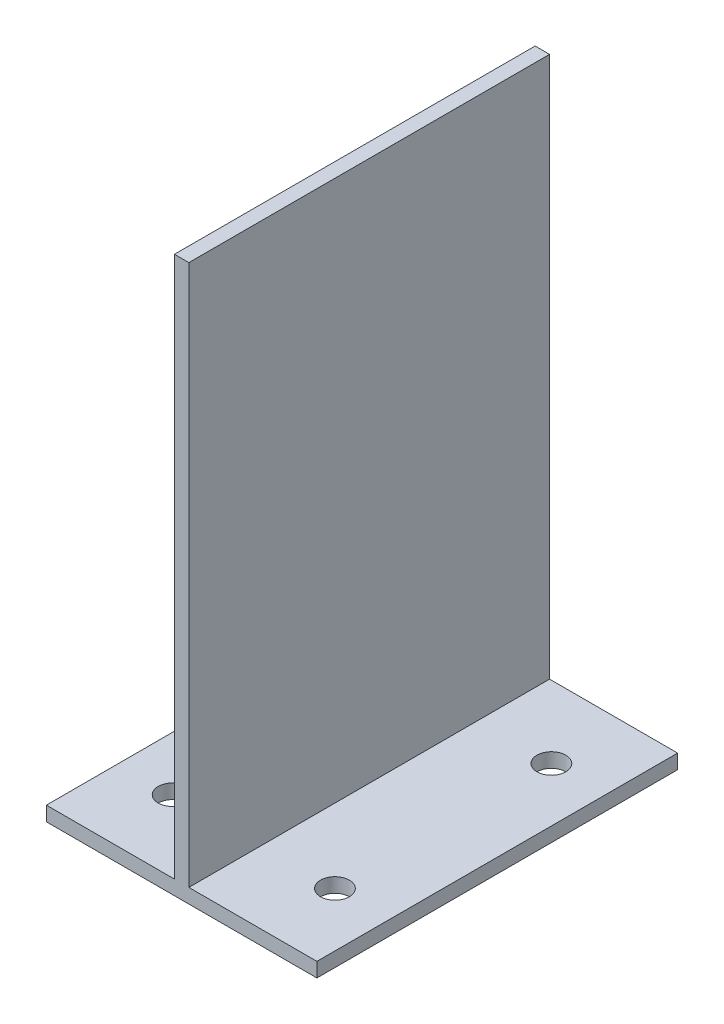
from build123d import *

# Parameters (mm, degrees)
BOSS_EXTRUDE1_DEPTH      = 200
F_16_0_MM_DOWEL_HOLES1_D = 16


with BuildPart() as part:
    # Sketch1 → Boss-Extrude1 (new body)
    with BuildSketch(Plane.XY):
        Polygon((-4, 308), (-4, 8), (-75, 8), (-75, 0), (75, 0), (75, 8), (4, 8), (4, 308), align=None)
    extrude(amount=BOSS_EXTRUDE1_DEPTH)

    # Ø16.0 mm Dowel Holes1 (through all)
    with Locations(Plane(origin=(0, 0, 0), x_dir=(-1, 0, 0), z_dir=(0, -1, 0))):
        with Locations((-45, -40), (-45, -160), (45, -160), (45, -40)):
            Hole(F_16_0_MM_DOWEL_HOLES1_D / 2)


solid = part.part
